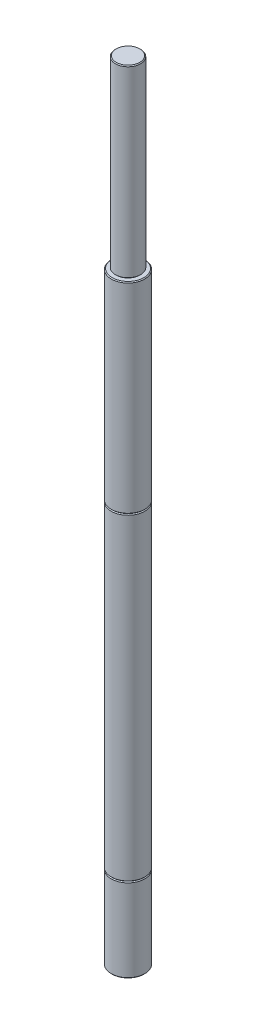
from build123d import *

# Parameters (mm, degrees)
SKETCH1_R           = 1.5
BOSS_EXTRUDE1_DEPTH = 22
SKETCH2_R           = 2
BOSS_EXTRUDE2_DEPTH = 24
SKETCH3_R           = 2
BOSS_EXTRUDE3_DEPTH = 38
SKETCH4_R           = 2
BOSS_EXTRUDE4_DEPTH = 10
CHAMFER1_SIZE       = 0.1
CHAMFER2_SIZE       = 0.1
CHAMFER3_SIZE       = 0.1
CHAMFER4_SIZE       = 0.1


with BuildPart() as part:
    # Sketch1 → Boss-Extrude1 (new body)
    with BuildSketch(Plane(origin=(0, 0, 0), x_dir=(1, 0, 0), z_dir=(0, 1, 0))):
        with Locations(Location((0, 0, 0), (0, 0, 270))):
            Circle(SKETCH1_R)
    extrude(amount=BOSS_EXTRUDE1_DEPTH)

    # Chamfer4
    chamfer4_edges = [part.edges().sort_by_distance(p)[0] for p in [
        (0, 0, -1.5),
        (0, 22, -1.5),
    ]]
    chamfer(chamfer4_edges, length=CHAMFER4_SIZE)


with BuildPart() as body_2:
    # Sketch2 → Boss-Extrude2 (new body)
    with BuildSketch(Plane.XZ):
        with Locations(Location((0, 0, 0), (0, 0, 270))):
            Circle(SKETCH2_R)
    extrude(amount=BOSS_EXTRUDE2_DEPTH)

    # Chamfer3
    chamfer3_edges = [body_2.edges().sort_by_distance(p)[0] for p in [
        (0, 0, 2),
        (0, -24, 2),
    ]]
    chamfer(chamfer3_edges, length=CHAMFER3_SIZE)


with BuildPart() as body_3:
    # Sketch3 → Boss-Extrude3 (new body)
    with BuildSketch(Plane.XZ.offset(24)):
        with Locations(Location((0, 0, 0), (0, 0, 270))):
            Circle(SKETCH3_R)
    extrude(amount=BOSS_EXTRUDE3_DEPTH)

    # Chamfer2
    chamfer2_edges = [body_3.edges().sort_by_distance(p)[0] for p in [
        (0, -24, 2),
        (0, -62, 2),
    ]]
    chamfer(chamfer2_edges, length=CHAMFER2_SIZE)


with BuildPart() as body_4:
    # Sketch4 → Boss-Extrude4 (new body)
    with BuildSketch(Plane.XZ.offset(62)):
        with Locations(Location((0, 0, 0), (0, 0, 270))):
            Circle(SKETCH4_R)
    extrude(amount=BOSS_EXTRUDE4_DEPTH)

    # Chamfer1
    chamfer1_edges = [body_4.edges().sort_by_distance(p)[0] for p in [
        (0, -62, 2),
        (0, -72, 2),
    ]]
    chamfer(chamfer1_edges, length=CHAMFER1_SIZE)


solid = Compound([part.part, body_2.part, body_3.part, body_4.part])
